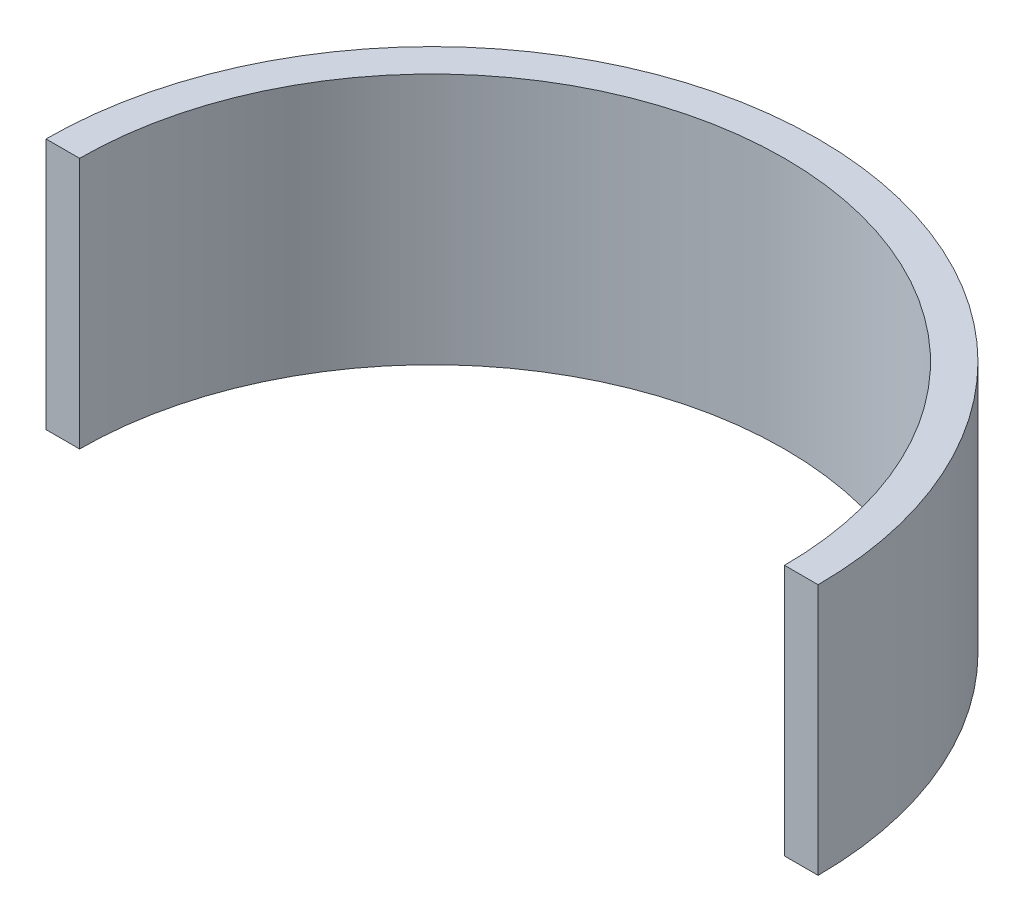
from build123d import *

# Parameters (mm, degrees)
EXTRUDE_1_DEPTH = 30


with BuildPart() as part:
    # 草图1 → 凸台-拉伸1 (new body)
    with BuildSketch(Plane(origin=(0, 0, 0), x_dir=(1, 0, 0), z_dir=(0, 1, 0))):
        with BuildLine():
            Line((-46, 0), (-42, 0))
            ThreePointArc((-42, 0), (0, 42), (42, 0))
            Line((42, 0), (46, 0))
            ThreePointArc((46, 0), (0, 46), (-46, 0))
        make_face()
    extrude(amount=EXTRUDE_1_DEPTH)


solid = part.part
